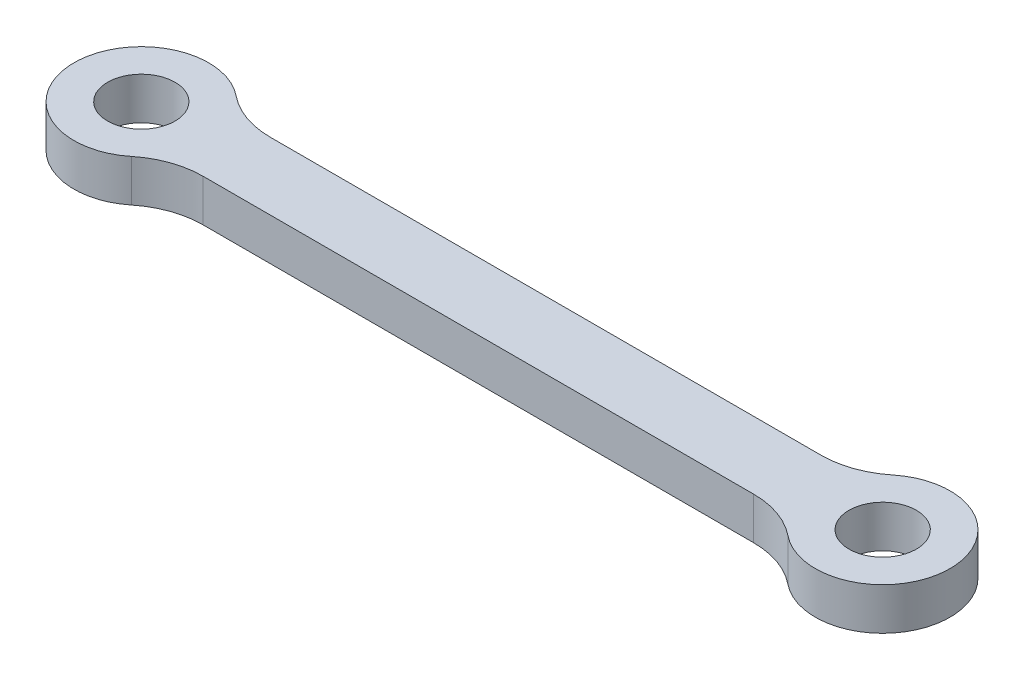
from build123d import *

# Parameters (mm, degrees)
SKETCH1_R           = 4
BOSS_EXTRUDE1_DEPTH = 5
FILLET1_R           = 10


with BuildPart() as part:
    # Sketch1 → Boss-Extrude1 (new body)
    with BuildSketch(Plane(origin=(0, 0, 0), x_dir=(1, 0, 0), z_dir=(0, 1, 0))):
        with BuildLine():
            Line((37.07179677, -4), (-37.07179677, -4))
            ThreePointArc((-37.07179677, -4), (-52, 0), (-37.07179677, 4))
            Line((-37.07179677, 4), (37.07179677, 4))
            ThreePointArc((37.07179677, 4), (52, 0), (37.07179677, -4))
        make_face()
        with Locations(Location((-44, 0, 0), (0, 0, 270))):
            Circle(SKETCH1_R, mode=Mode.SUBTRACT)
        with Locations(Location((44, 0, 0), (0, 0, 90))):
            Circle(SKETCH1_R, mode=Mode.SUBTRACT)
    extrude(amount=BOSS_EXTRUDE1_DEPTH)

    # Fillet1
    fillet1_edges = [part.edges().sort_by_distance(p)[0] for p in [
        (-37.07179677, 2.5, -4),
        (37.07179677, 2.5, -4),
        (37.07179677, 2.5, 4),
        (-37.07179677, 2.5, 4),
    ]]
    fillet(fillet1_edges, radius=FILLET1_R)


solid = part.part
